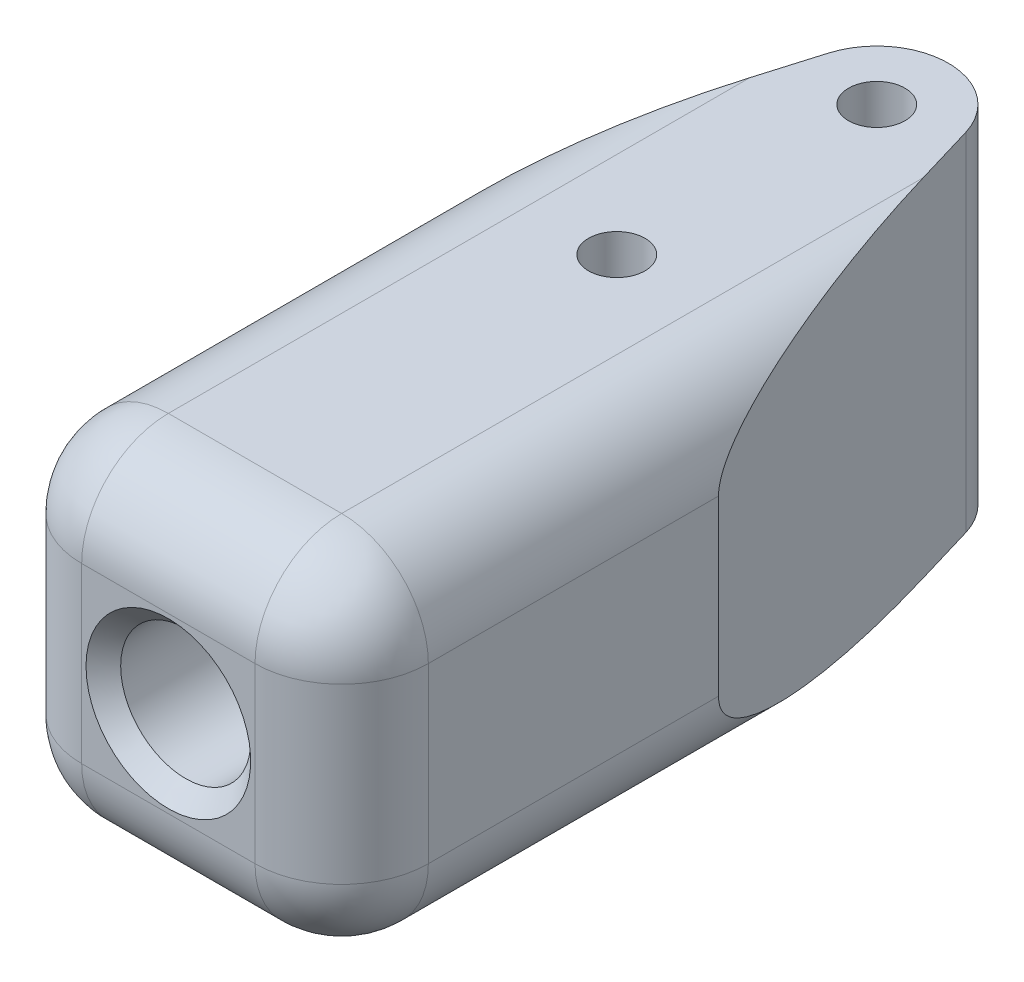
from build123d import *

# Parameters (mm, degrees)
SKETCH1_W               = 25.4
SKETCH1_H               = 25.4
BOSS_EXTRUDE1_DEPTH     = 57.15
CUT_EXTRUDE1_DEPTH      = 64.816710194
CUT_EXTRUDE1_DEPTH_BACK = 64.816710194
SKETCH2_R               = 2.0701
SKETCH4_R               = 4.7625
CUT_EXTRUDE2_DEPTH      = 25.4
CHAMFER1_SIZE           = 1.27
FILLET1_R               = 6.35
FILLET2_R               = 6.35


with BuildPart() as part:
    # Sketch1 → Boss-Extrude1 (new body)
    with BuildSketch(Plane.XY):
        Rectangle(SKETCH1_W, SKETCH1_H)
    extrude(amount=BOSS_EXTRUDE1_DEPTH)

    # Sketch2 → Cut-Extrude1 (cut, two sides: drawn at the far end of the back side and taken through both)
    with BuildSketch(Plane(origin=(0, 12.7, 0), x_dir=(1, 0, 0), z_dir=(0, 1, 0)).offset(-CUT_EXTRUDE1_DEPTH_BACK)):
        with BuildLine():
            Line((-12.7, 0), (-12.7, -29.5402))
            Line((-12.7, -29.5402), (-5.027345066, -3.749481199))
            ThreePointArc((-5.027345066, -3.749481199), (-3.135793664, -1.040593833), (7e-09, 0))
            Line((7e-09, 0), (-12.7, 0))
        make_face()
        with BuildLine():
            Line((5.027345066, -3.749481199), (12.7, -29.5402))
            Line((12.7, -29.5402), (12.7, 0))
            Line((12.7, 0), (7e-09, 0))
            ThreePointArc((7e-09, 0), (3.135793669, -1.040593837), (5.027345066, -3.749481199))
        make_face()
        with Locations(Location((0, -5.2451, 0), (0, 0, 180))):
            Circle(SKETCH2_R)
        with Locations(Location((0, -24.2951, 0), (0, 0, 180))):
            Circle(SKETCH2_R)
    extrude(amount=CUT_EXTRUDE1_DEPTH + CUT_EXTRUDE1_DEPTH_BACK, mode=Mode.SUBTRACT)

    # Sketch4 → Cut-Extrude2 (cut)
    with BuildSketch(Plane.XY.offset(57.15)):
        Circle(SKETCH4_R)
    extrude(amount=-CUT_EXTRUDE2_DEPTH, mode=Mode.SUBTRACT)

    # Chamfer1
    chamfer1_edges = [part.edges().sort_by_distance(p)[0] for p in [
        (-4.7625, 0, 57.15),
    ]]
    chamfer(chamfer1_edges, length=CHAMFER1_SIZE)

    # Fillet1
    fillet1_edges = [part.edges().sort_by_distance(p)[0] for p in [
        (12.7, 0, 57.15),
        (-12.7, 0, 57.15),
        (0, -12.7, 57.15),
        (12.7, -12.7, 43.3451),
        (-12.7, -12.7, 43.3451),
    ]]
    fillet(fillet1_edges, radius=FILLET1_R)

    # Fillet2
    fillet2_edges = [part.edges().sort_by_distance(p)[0] for p in [
        (-12.7, 12.7, 40.1701),
        (12.7, 12.7, 40.1701),
        (0, 12.7, 57.15),
        (10.840128061, 12.7, 55.290128061),
        (-10.840128061, 12.7, 55.290128061),
    ]]
    fillet(fillet2_edges, radius=FILLET2_R)


solid = part.part
